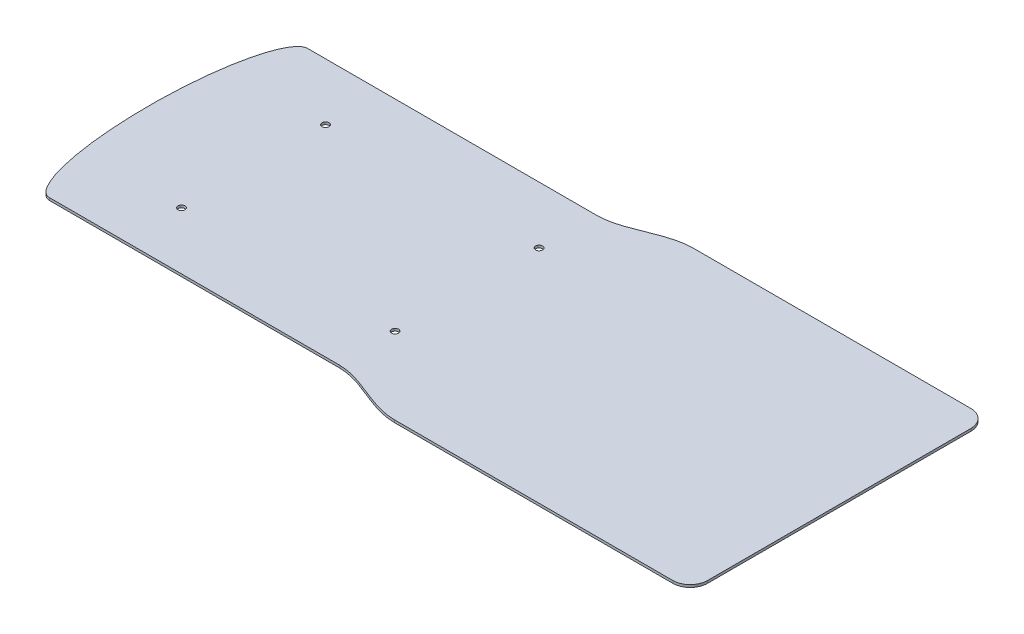
from build123d import *

# Parameters (mm, degrees)
SKETCH_1_W          = 278
SKETCH_1_H          = 120
EXTRUDE_1_DEPTH     = 1
SKETCH_2_W          = 129
SKETCH_2_H          = 8
CUT_EXTRUDE_1_DEPTH = 1
CUT_EXTRUDE_2_DEPTH = 1
CUT_EXTRUDE_4_DEPTH = 1
CUT_EXTRUDE_5_DEPTH = 1
SKETCH_16_R         = 1.39979
CUT_EXTRUDE_9_DEPTH = 10


with BuildPart() as part:
    # 스케치1 → 보스-돌출1 (new body)
    with BuildSketch(Plane(origin=(0, 0, 0), x_dir=(1, 0, 0), z_dir=(0, 1, 0))):
        Rectangle(SKETCH_1_W, SKETCH_1_H)
    extrude(amount=EXTRUDE_1_DEPTH)

    # 스케치2 → 컷-돌출1 (cut)
    with BuildSketch(Plane(origin=(0, 1, 0), x_dir=(1, 0, 0), z_dir=(0, 1, 0))):
        with Locations((-74.5, -56)):
            Rectangle(SKETCH_2_W, SKETCH_2_H)
        with Locations((-74.5, 56)):
            Rectangle(SKETCH_2_W, SKETCH_2_H)
    extrude(amount=-CUT_EXTRUDE_1_DEPTH, mode=Mode.SUBTRACT)

    # 스케치3 → 컷-돌출2 (cut)
    with BuildSketch(Plane(origin=(0, 1, 0), x_dir=(1, 0, 0), z_dir=(0, 1, 0))):
        with BuildLine():
            add(Edge.make_bspline(
                [(-127, 52), (-139, 52), (-139, 0)],
                knots=[3.141592654, 3.141592654, 3.141592654, 4.71238898, 4.71238898, 4.71238898], degree=2, weights=[1, 0.707106781, 1]))
            Line((-127, 52), (-139, 52))
            Line((-139, 52), (-139, 0))
        make_face()
        with BuildLine():
            Line((-139, -52), (-127, -52))
            add(Edge.make_bspline(
                [(-139, 0), (-139, -52), (-127, -52)],
                knots=[4.71238898, 4.71238898, 4.71238898, 6.283185307, 6.283185307, 6.283185307], degree=2, weights=[1, 0.707106781, 1]))
            Line((-139, 0), (-139, -52))
        make_face()
    extrude(amount=-CUT_EXTRUDE_2_DEPTH, mode=Mode.SUBTRACT)

    # 스케치4 → 컷-돌출4 (cut)
    with BuildSketch(Plane(origin=(0, 1, 0), x_dir=(1, 0, 0), z_dir=(0, 1, 0))):
        with BuildLine():
            Line((-10, 52), (-10, 60))
            Line((-10, 60), (20, 60))
            add(Edge.make_bspline(
                [(-10, 52), (0.64121866, 52.367223255), (9.376693721, 59.919927591), (20, 60)],
                knots=[0, 0, 0, 0, 1, 1, 1, 1], degree=3))
        make_face()
        with BuildLine():
            Line((-10, -52), (-10, -60))
            Line((-10, -60), (20, -60))
            add(Edge.make_bspline(
                [(-10, -52), (0.64121866, -52.367223255), (9.376693721, -59.919927591), (20, -60)],
                knots=[0, 0, 0, 0, 1, 1, 1, 1], degree=3))
        make_face()
    extrude(amount=-CUT_EXTRUDE_4_DEPTH, mode=Mode.SUBTRACT)

    # 스케치5 → 컷-돌출5 (cut)
    with BuildSketch(Plane(origin=(0, 1, 0), x_dir=(1, 0, 0), z_dir=(0, 1, 0))):
        with BuildLine():
            Line((132, 60), (139, 60))
            Line((139, 60), (139, 53))
            ThreePointArc((139, 53), (136.949747468, 57.949747468), (132, 60))
        make_face()
        with BuildLine():
            Line((139, -60), (139, -53))
            ThreePointArc((139, -53), (136.949747468, -57.949747468), (132, -60))
            Line((132, -60), (139, -60))
        make_face()
    extrude(amount=-CUT_EXTRUDE_5_DEPTH, mode=Mode.SUBTRACT)

    # 스케치16 → 컷-돌출9 (cut)
    with BuildSketch(Plane(origin=(0, 1, 0), x_dir=(1, 0, 0), z_dir=(0, 1, 0))):
        with Locations(Location((-96.85129, 29.0311, 0), (0, 0, 270))):
            Circle(SKETCH_16_R)
        with Locations(Location((-96.85109, -28.96802, 0), (0, 0, 270))):
            Circle(SKETCH_16_R)
        with Locations(Location((-10.85223, 29.03265, 0), (0, 0, 270))):
            Circle(SKETCH_16_R)
        with Locations(Location((-10.8511, -28.96784, 0), (0, 0, 270))):
            Circle(SKETCH_16_R)
    extrude(amount=-CUT_EXTRUDE_9_DEPTH, mode=Mode.SUBTRACT)


solid = part.part
